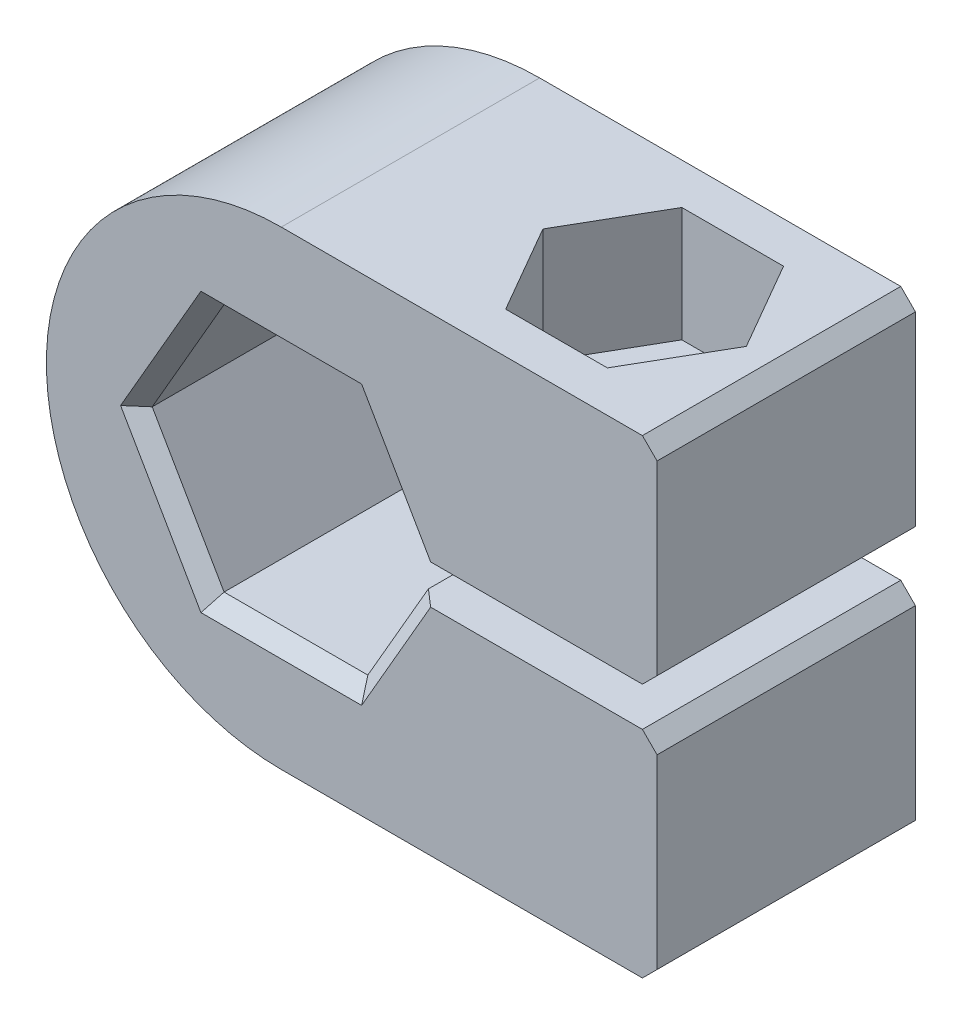
from build123d import *

# Parameters (mm, degrees)
BOSS_EXTRUDE1_DEPTH = 13.97
CHAMFER1_SIZE       = 0.79375
SKETCH3_R           = 2.4892
CUT_EXTRUDE1_DEPTH  = 36.400894057
CUT_EXTRUDE2_DEPTH  = 6.2
SKETCH5_R           = 4.064
CUT_EXTRUDE3_DEPTH  = 6.35
CHAFL_N1_SIZE       = 0.79375


with BuildPart() as part:
    # Sketch2 → Boss-Extrude1 (new body)
    with BuildSketch(Plane.XY):
        with BuildLine():
            Line((3.886144662, -6.731), (7.161260289, -1.058333333))
            Line((7.161260289, -1.058333333), (10.16, -1.058333333))
            Line((10.16, -1.058333333), (20.32, -1.058333333))
            Line((20.32, -1.058333333), (20.32, -12.7))
            Line((20.32, -12.7), (0, -12.7))
            ThreePointArc((0, -12.7), (-12.7, 0), (0, 12.7))
            Line((0, 12.7), (20.32, 12.7))
            Line((20.32, 12.7), (20.32, 1.058333333))
            Line((20.32, 1.058333333), (10.16, 1.058333333))
            Line((10.16, 1.058333333), (7.161260289, 1.058333333))
            Line((7.161260289, 1.058333333), (3.886144662, 6.731))
            Line((3.886144662, 6.731), (-3.886144662, 6.731))
            Line((-3.886144662, 6.731), (-7.772289324, 0))
            Line((-7.772289324, 0), (-3.886144662, -6.731))
            Line((-3.886144662, -6.731), (3.886144662, -6.731))
        make_face()
    extrude(amount=BOSS_EXTRUDE1_DEPTH)

    # Chamfer1
    chamfer1_edges = [part.edges().sort_by_distance(p)[0] for p in [
        (5.523702475, 3.894666667, 0),
        (0, 6.731, 0),
        (-5.829216993, 3.3655, 0),
        (-5.829216993, -3.3655, 0),
        (0, -6.731, 0),
        (5.523702475, -3.894666667, 0),
        (20.32, -1.058333333, 6.985),
        (20.32, -12.7, 6.985),
        (20.32, 12.7, 6.985),
        (20.32, 1.058333333, 6.985),
        (5.523702475, -3.894666667, 13.97),
        (0, -6.731, 13.97),
        (-5.829216993, -3.3655, 13.97),
        (-5.829216993, 3.3655, 13.97),
        (0, 6.731, 13.97),
        (5.523702475, 3.894666667, 13.97),
    ]]
    chamfer(chamfer1_edges, length=CHAMFER1_SIZE)

    # Sketch3 → Cut-Extrude1 (cut, through all)
    with BuildSketch(Plane(origin=(0, 12.7, 0), x_dir=(1, 0, 0), z_dir=(0, 1, 0))):
        with Locations(Location((12.660521603, -6.985, 0), (0, 0, 180))):
            Circle(SKETCH3_R)
    extrude(amount=-CUT_EXTRUDE1_DEPTH, mode=Mode.SUBTRACT)

    # Sketch4 → Cut-Extrude2 (cut)
    with BuildSketch(Plane(origin=(0, 12.7, 0), x_dir=(1, 0, 0), z_dir=(0, 1, 0))):
        Polygon((9.910890946, -11.7475), (15.41015226, -11.7475), (18.159782917, -6.985), (15.41015226, -2.2225), (9.910890946, -2.2225), (7.161260289, -6.985), align=None)
    extrude(amount=-CUT_EXTRUDE2_DEPTH, mode=Mode.SUBTRACT)

    # Sketch5 → Cut-Extrude3 (cut)
    with BuildSketch(Plane.XZ.offset(12.7)):
        with Locations((12.660521603, 6.985)):
            Circle(SKETCH5_R)
    extrude(amount=-CUT_EXTRUDE3_DEPTH, mode=Mode.SUBTRACT)

    # Chaflán1
    chafl_n1_edges = [part.edges().sort_by_distance(p)[0] for p in [
        (15.149721603, -1.058333333, 6.985),
        (15.149721603, 1.058333333, 6.985),
        (8.596521603, -12.7, 6.985),
    ]]
    chamfer(chafl_n1_edges, length=CHAFL_N1_SIZE)


solid = part.part
